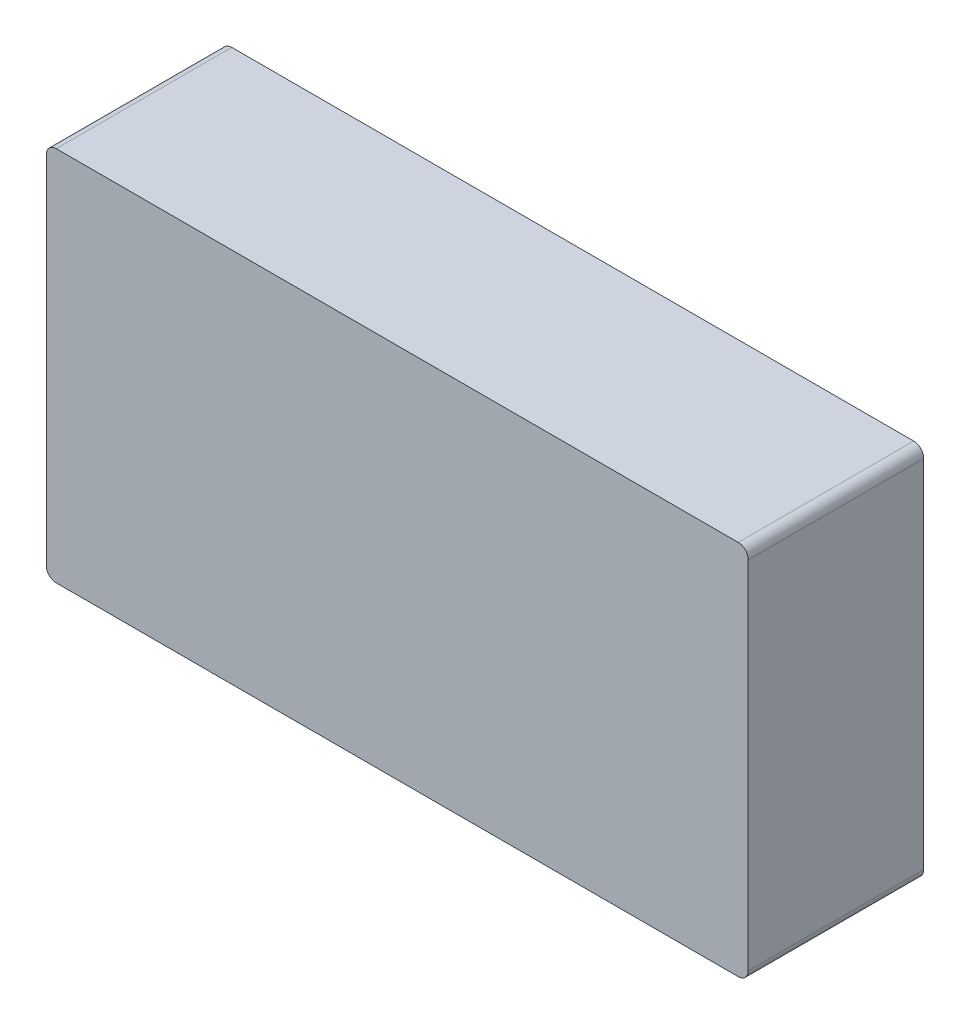
from build123d import *

# Parameters (mm, degrees)
SKETCH1_W           = 140
SKETCH1_H           = 75
BOSS_EXTRUDE1_DEPTH = 35
SHELL1_T            = -2.5
FILLET1_R           = 2


with BuildPart() as part:
    # Sketch1 → Boss-Extrude1 (new body)
    with BuildSketch(Plane.XY):
        Rectangle(SKETCH1_W, SKETCH1_H)
    extrude(amount=BOSS_EXTRUDE1_DEPTH)

    # Shell1
    shell1_openings = [part.faces().sort_by_distance(p)[0] for p in [
        (0, 0, 0),
    ]]
    offset(amount=SHELL1_T, openings=shell1_openings, kind=Kind.INTERSECTION)

    # Fillet1
    fillet1_edges = [part.edges().sort_by_distance(p)[0] for p in [
        (70, -37.5, 17.5),
        (-70, -37.5, 17.5),
        (-70, 37.5, 17.5),
        (70, 37.5, 17.5),
    ]]
    fillet(fillet1_edges, radius=FILLET1_R)


solid = part.part
